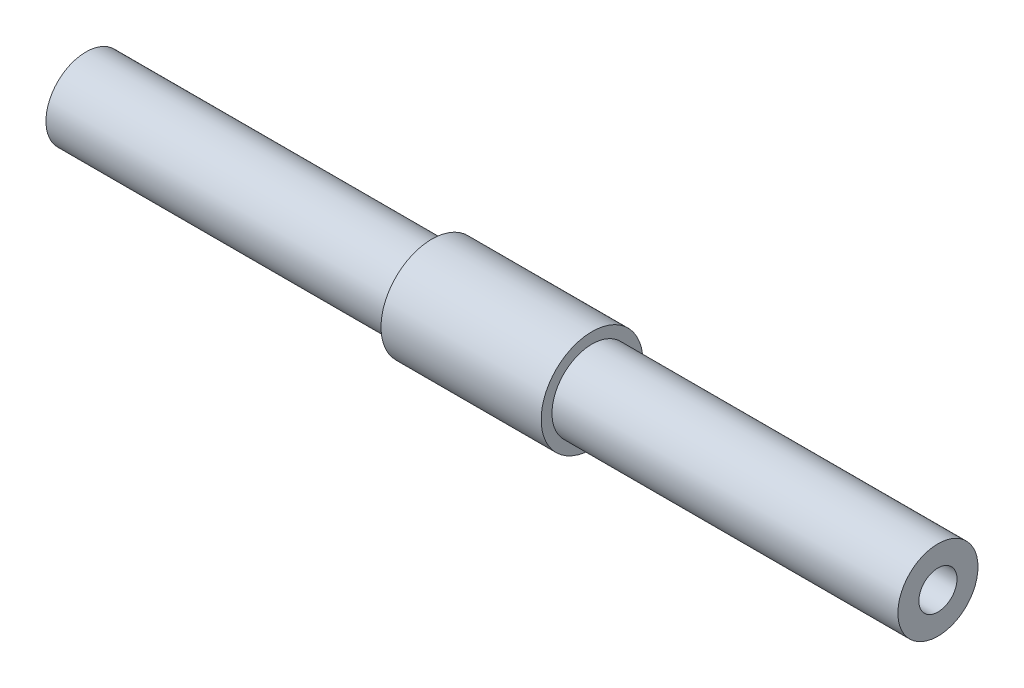
from build123d import *

# Parameters (mm, degrees)
CROQUIS2_R            = 2.38125
CORTAR_EXTRUIR1_DEPTH = 10


with BuildPart() as part:
    # Croquis1 → Revolución1 (revolve)
    with BuildSketch(Plane(origin=(0, 0, 0), x_dir=(1, 0, 0), z_dir=(0, 1, 0))):
        Polygon((9.995, 6.35), (-10, 6.35), (-10, 5), (-53.175, 5), (-53.175, 0), (53.175, 0), (53.175, 5), (9.995, 5), align=None)
    revolve(axis=Axis((53.175, 0, 0), (-1, 0, 0)))

    # Croquis2 → Cortar-Extruir1 (cut)
    with BuildSketch(Plane.ZY.offset(53.175)):
        Circle(CROQUIS2_R)
    cortar_extruir1 = extrude(amount=-CORTAR_EXTRUIR1_DEPTH, mode=Mode.SUBTRACT)

    # Simetría1: Cortar-Extruir1 across plane
    add(cortar_extruir1.mirror(Plane.ZY.offset(-3.175)), mode=Mode.SUBTRACT)


solid = part.part
